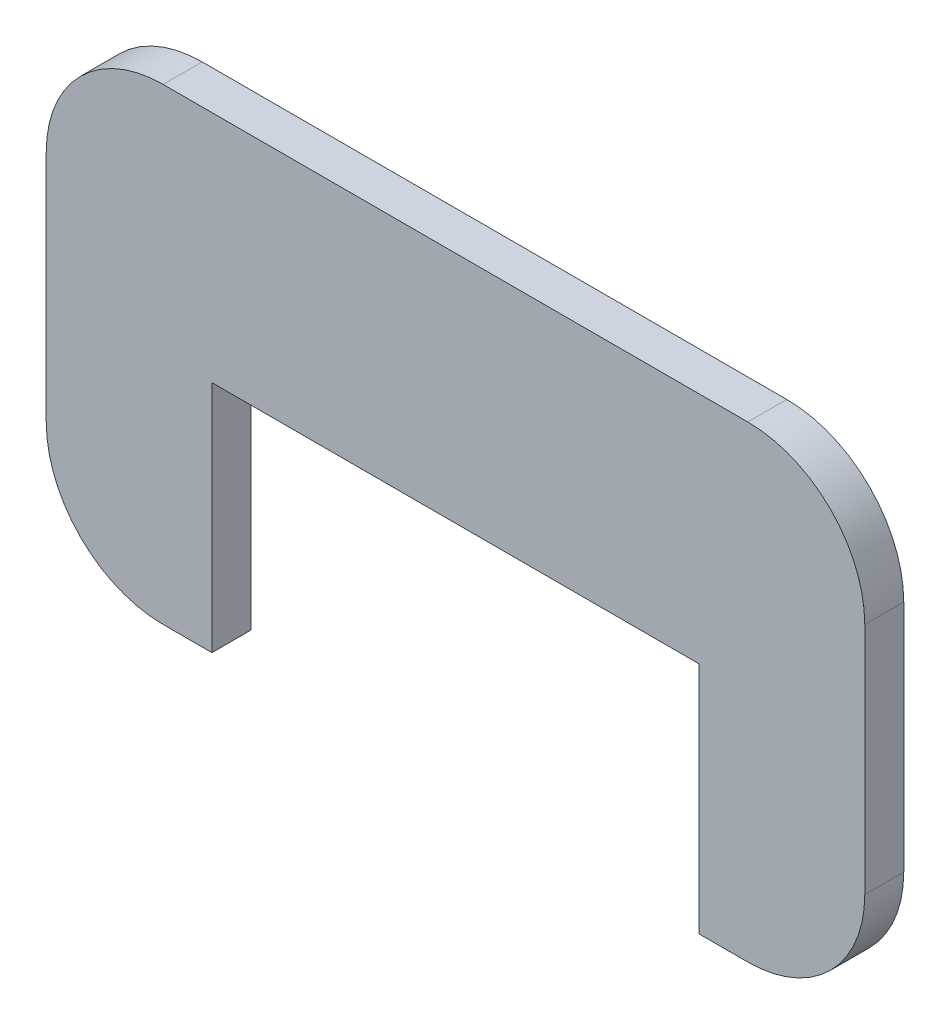
from build123d import *

# Parameters (mm, degrees)
BOSS_EXTRUDE1_DEPTH = 1
FILLET2_R           = 3


with BuildPart() as part:
    # Sketch1 → Boss-Extrude1 (new body)
    with BuildSketch(Plane.XY):
        Polygon((19, 10), (8.5, 10), (8.5, 8), (17, 8), (17, 0), (14.75, 0), (14.75, -2), (19, -2), align=None)
        Polygon((-2, 10), (-2, -2), (2.25, -2), (2.25, 0), (0, 0), (0, 8), (8.5, 8), (8.5, 10), align=None)
        Polygon((0, 0), (2.25, 0), (2.25, 1), (1, 1), (1, 7), (8.5, 7), (8.5, 8), (0, 8), align=None)
        Polygon((1, 1), (2.25, 1), (2.25, 4), (8.5, 4), (8.5, 7), (1, 7), align=None)
        Polygon((16, 7), (8.5, 7), (8.5, 4), (14.75, 4), (14.75, 1), (16, 1), align=None)
        Polygon((17, 8), (8.5, 8), (8.5, 7), (16, 7), (16, 1), (14.75, 1), (14.75, 0), (17, 0), align=None)
    extrude(amount=BOSS_EXTRUDE1_DEPTH)

    # Fillet2
    fillet2_edges = [part.edges().sort_by_distance(p)[0] for p in [
        (-2, -2, 0.5),
        (-2, 10, 0.5),
        (19, 10, 0.5),
        (19, -2, 0.5),
    ]]
    fillet(fillet2_edges, radius=FILLET2_R)


solid = part.part
